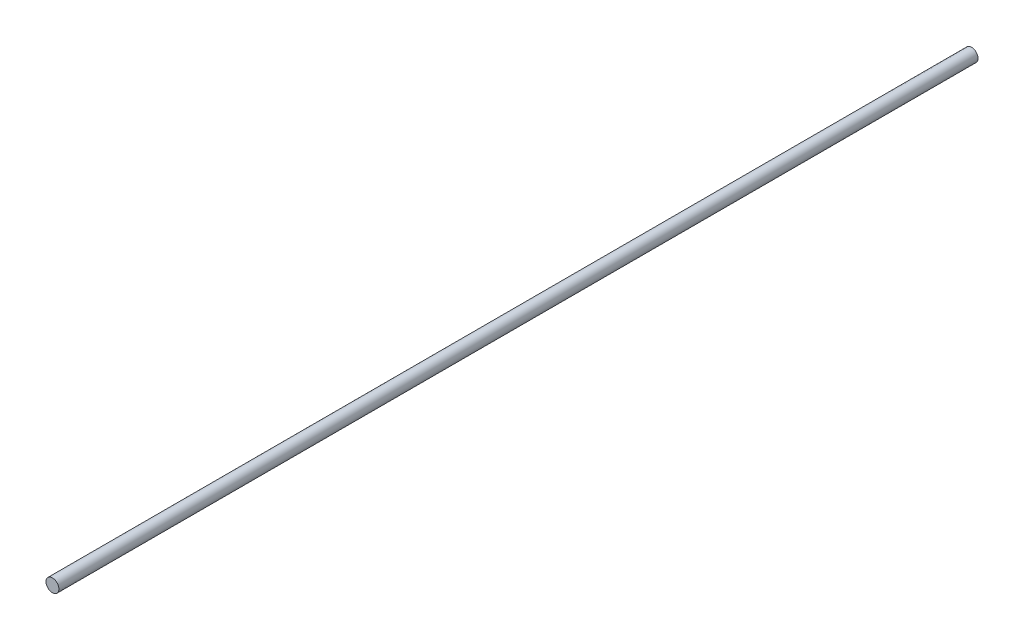
from build123d import *

# Parameters (mm, degrees)
SKETCH1_R           = 4
BOSS_EXTRUDE1_DEPTH = 285


with BuildPart() as part:
    # Sketch1 → Boss-Extrude1 (new, symmetric)
    with BuildSketch(Plane.XY):
        Circle(SKETCH1_R)
    extrude(amount=BOSS_EXTRUDE1_DEPTH, both=True)


solid = part.part
